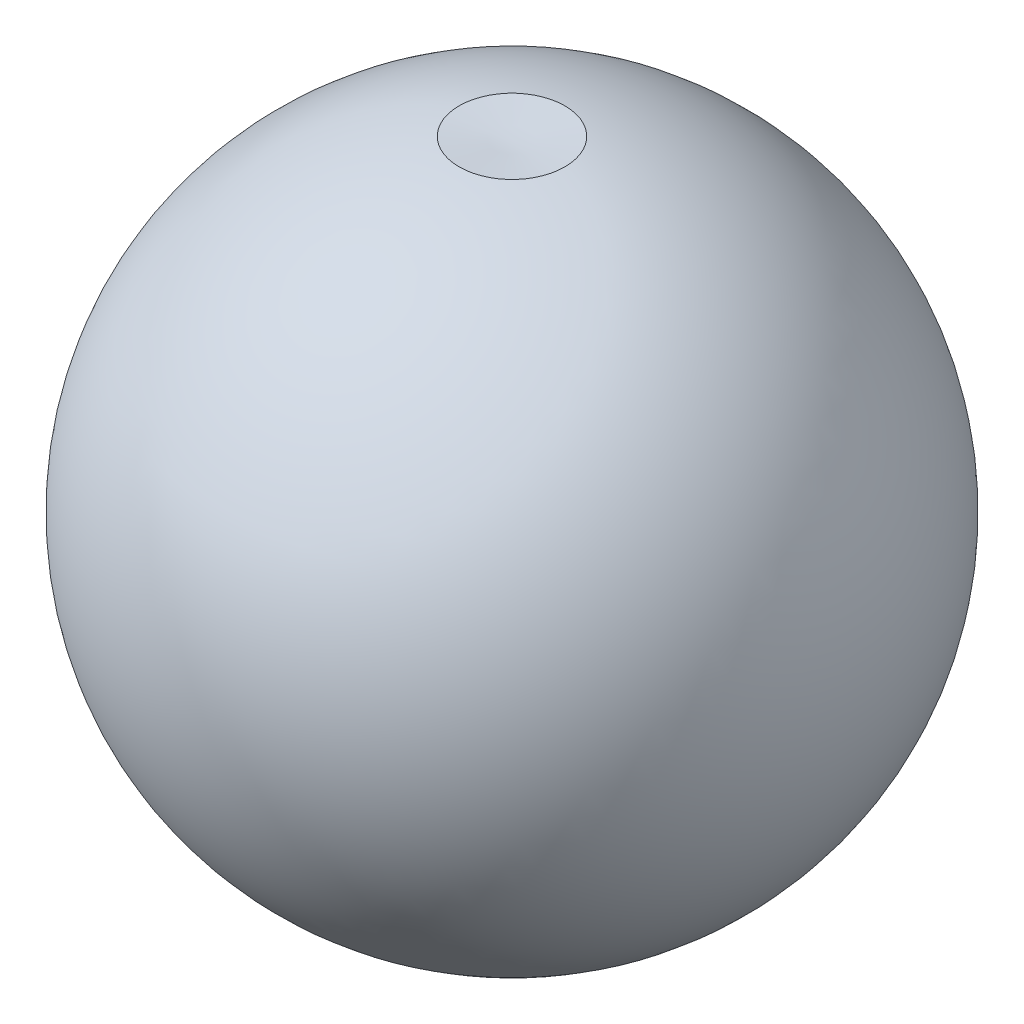
from build123d import *


with BuildPart() as part:
    # Esquisse1 → BASE (revolve)
    with BuildSketch(Plane.XY):
        with BuildLine():
            Line((0, 29.580398915), (0, -30))
            Line((0, -30), (4.875337777, -30))
            ThreePointArc((4.875337777, -30), (30.393567057, 0), (4.875337777, 30))
            Line((4.875337777, 30), (0, 29.580398915))
        make_face()
    revolve(axis=Axis((0, 29.580398915, 0), (0, -1, 0)))


solid = part.part
